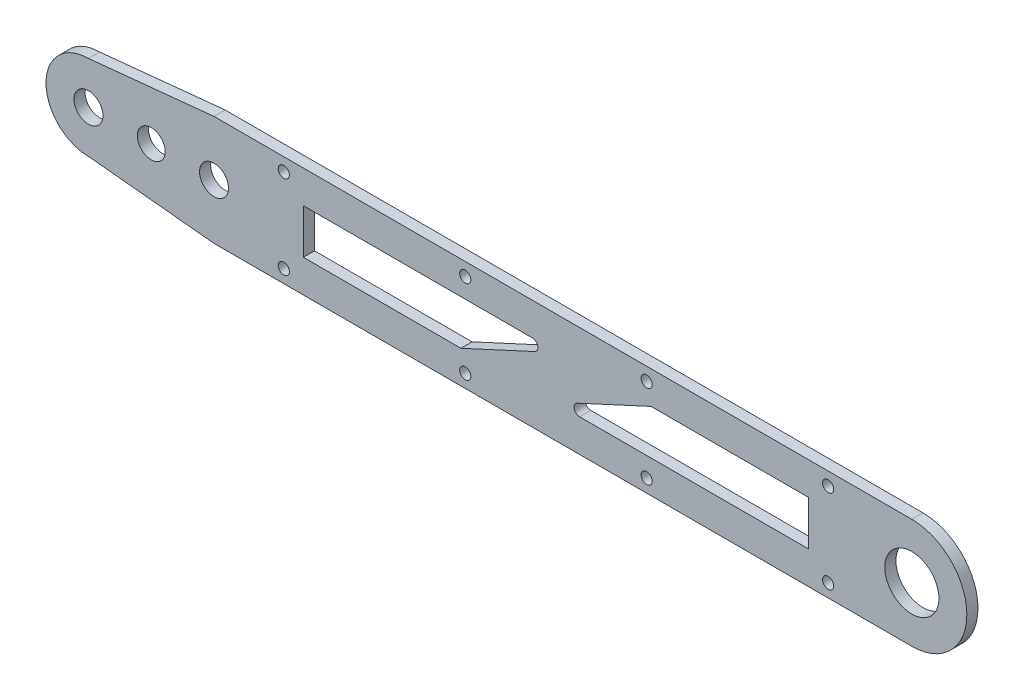
from build123d import *

# Parameters (mm, degrees)
SKETCH_1_R          = 5.2
SKETCH_1_R_2        = 9.7
EXTRUDE_1_DEPTH     = 4
SKETCH_2_R          = 2
CUT_EXTRUDE_1_DEPTH = 10
SKETCH_3_R          = 5
CUT_EXTRUDE_2_DEPTH = 10


with BuildPart() as part:
    # 草图1 → 凸台-拉伸1 (new body)
    with BuildSketch(Plane.XY):
        with BuildLine():
            Line((250, 19.7), (0, 19.7))
            Line((0, 19.7), (-45, 15.2))
            ThreePointArc((-45, 15.2), (-60.2, 0), (-45, -15.2))
            Line((-45, -15.2), (0, -19.7))
            Line((0, -19.7), (250, -19.7))
            ThreePointArc((250, -19.7), (269.7, 0), (250, 19.7))
        make_face()
        Circle(SKETCH_1_R, mode=Mode.SUBTRACT)
        with Locations((250, 0)):
            Circle(SKETCH_1_R_2, mode=Mode.SUBTRACT)
        with Locations((-45, 0)):
            Circle(SKETCH_1_R, mode=Mode.SUBTRACT)
    extrude(amount=EXTRUDE_1_DEPTH)

    # 草图2 → 切除-拉伸1 (cut)
    with BuildSketch(Plane.XY.offset(4)):
        with Locations((25, 15)):
            Circle(SKETCH_2_R)
        with Locations((90, 15)):
            Circle(SKETCH_2_R)
        with Locations((155, 15)):
            Circle(SKETCH_2_R)
        with Locations((220, 15)):
            Circle(SKETCH_2_R)
        with Locations((90, -15)):
            Circle(SKETCH_2_R)
        with Locations((155, -15)):
            Circle(SKETCH_2_R)
        with Locations((220, -15)):
            Circle(SKETCH_2_R)
        with Locations((25, -15)):
            Circle(SKETCH_2_R)
    extrude(amount=-CUT_EXTRUDE_1_DEPTH, mode=Mode.SUBTRACT)

    # 草图3 → 切除-拉伸2 (cut)
    with BuildSketch(Plane.XY.offset(4)):
        with Locations((-22.5, 0)):
            Circle(SKETCH_3_R)
        with BuildLine():
            Line((32, 8), (32, -8))
            Line((32, -8), (88.462542093, -8))
            Line((88.462542093, -8), (114.86138476, 4.184081231))
            ThreePointArc((114.86138476, 4.184081231), (115.976706085, 6.429046887), (114.023268405, 8))
            Line((114.023268405, 8), (32, 8))
        make_face()
        with BuildLine():
            Line((156.537457907, 8), (213, 8))
            Line((213, 8), (213, -8))
            Line((213, -8), (130.976731595, -8))
            ThreePointArc((130.976731595, -8), (129.023293915, -6.429046887), (130.13861524, -4.184081231))
            Line((130.13861524, -4.184081231), (156.537457907, 8))
        make_face()
    extrude(amount=-CUT_EXTRUDE_2_DEPTH, mode=Mode.SUBTRACT)


solid = part.part
